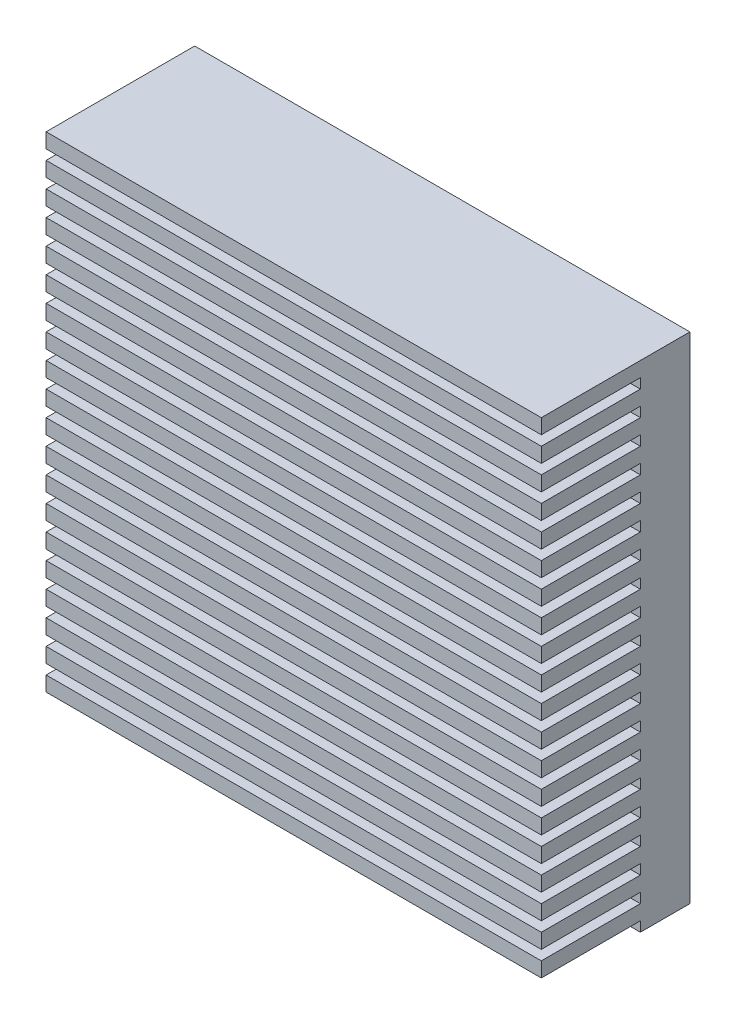
from build123d import *

# Parameters (mm, degrees)
SKETCH1_W           = 50
SKETCH1_H           = 50
BOSS_EXTRUDE1_DEPTH = 5
SKETCH2_W           = 50
SKETCH2_H           = 1.5
BOSS_EXTRUDE2_DEPTH = 10


with BuildPart() as part:
    # Sketch1 → Boss-Extrude1 (new body)
    with BuildSketch(Plane.XY):
        Rectangle(SKETCH1_W, SKETCH1_H)
    extrude(amount=BOSS_EXTRUDE1_DEPTH)

    # Sketch2 → Boss-Extrude2 (add)
    with BuildSketch(Plane.XY.offset(5)):
        with Locations((0, 24.25)):
            Rectangle(SKETCH2_W, SKETCH2_H)
        with Locations((0, 21.75)):
            Rectangle(SKETCH2_W, SKETCH2_H)
        with Locations((0, 19.25)):
            Rectangle(SKETCH2_W, SKETCH2_H)
        with Locations((0, 16.75)):
            Rectangle(SKETCH2_W, SKETCH2_H)
        with Locations((0, 14.25)):
            Rectangle(SKETCH2_W, SKETCH2_H)
        with Locations((0, 11.75)):
            Rectangle(SKETCH2_W, SKETCH2_H)
        with Locations((0, 9.25)):
            Rectangle(SKETCH2_W, SKETCH2_H)
        with Locations((0, 6.75)):
            Rectangle(SKETCH2_W, SKETCH2_H)
        with Locations((0, 4.25)):
            Rectangle(SKETCH2_W, SKETCH2_H)
        with Locations((0, 1.75)):
            Rectangle(SKETCH2_W, SKETCH2_H)
        with Locations((0, -0.75)):
            Rectangle(SKETCH2_W, SKETCH2_H)
        with Locations((0, -3.25)):
            Rectangle(SKETCH2_W, SKETCH2_H)
        with Locations((0, -5.75)):
            Rectangle(SKETCH2_W, SKETCH2_H)
        with Locations((0, -8.25)):
            Rectangle(SKETCH2_W, SKETCH2_H)
        with Locations((0, -10.75)):
            Rectangle(SKETCH2_W, SKETCH2_H)
        with Locations((0, -13.25)):
            Rectangle(SKETCH2_W, SKETCH2_H)
        with Locations((0, -15.75)):
            Rectangle(SKETCH2_W, SKETCH2_H)
        with Locations((0, -18.25)):
            Rectangle(SKETCH2_W, SKETCH2_H)
        with Locations((0, -20.75)):
            Rectangle(SKETCH2_W, SKETCH2_H)
        with Locations((0, -23.25)):
            Rectangle(SKETCH2_W, SKETCH2_H)
    extrude(amount=BOSS_EXTRUDE2_DEPTH)


solid = part.part
